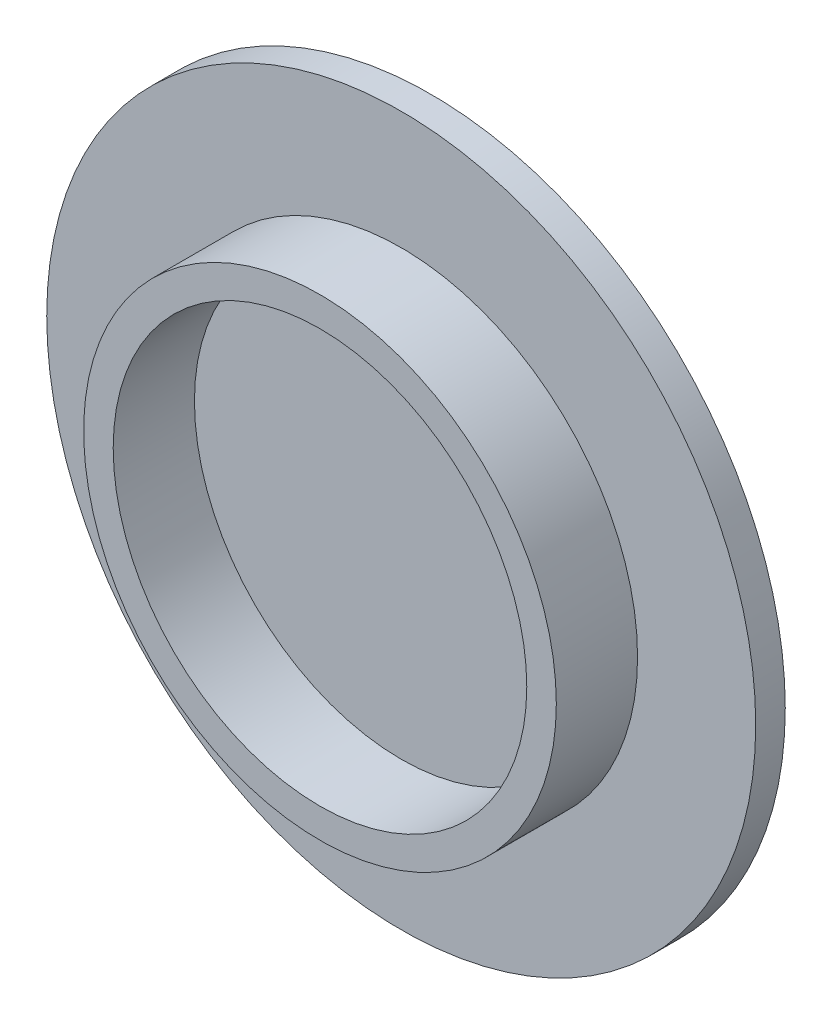
from build123d import *

# Parameters (mm, degrees)
SKETCH_1_R      = 120
EXTRUDE_1_DEPTH = 10
SKETCH_2_R      = 80
SKETCH_2_R_2    = 70
EXTRUDE_2_DEPTH = 27.5


with BuildPart() as part:
    # 草图1 → 拉伸1 (new body)
    with BuildSketch(Plane.XY):
        Circle(SKETCH_1_R)
    extrude(amount=EXTRUDE_1_DEPTH)

    # 草图2 → 拉伸2 (add)
    with BuildSketch(Plane.XY.offset(10)):
        Circle(SKETCH_2_R)
        Circle(SKETCH_2_R_2, mode=Mode.SUBTRACT)
    extrude(amount=EXTRUDE_2_DEPTH)


solid = part.part
